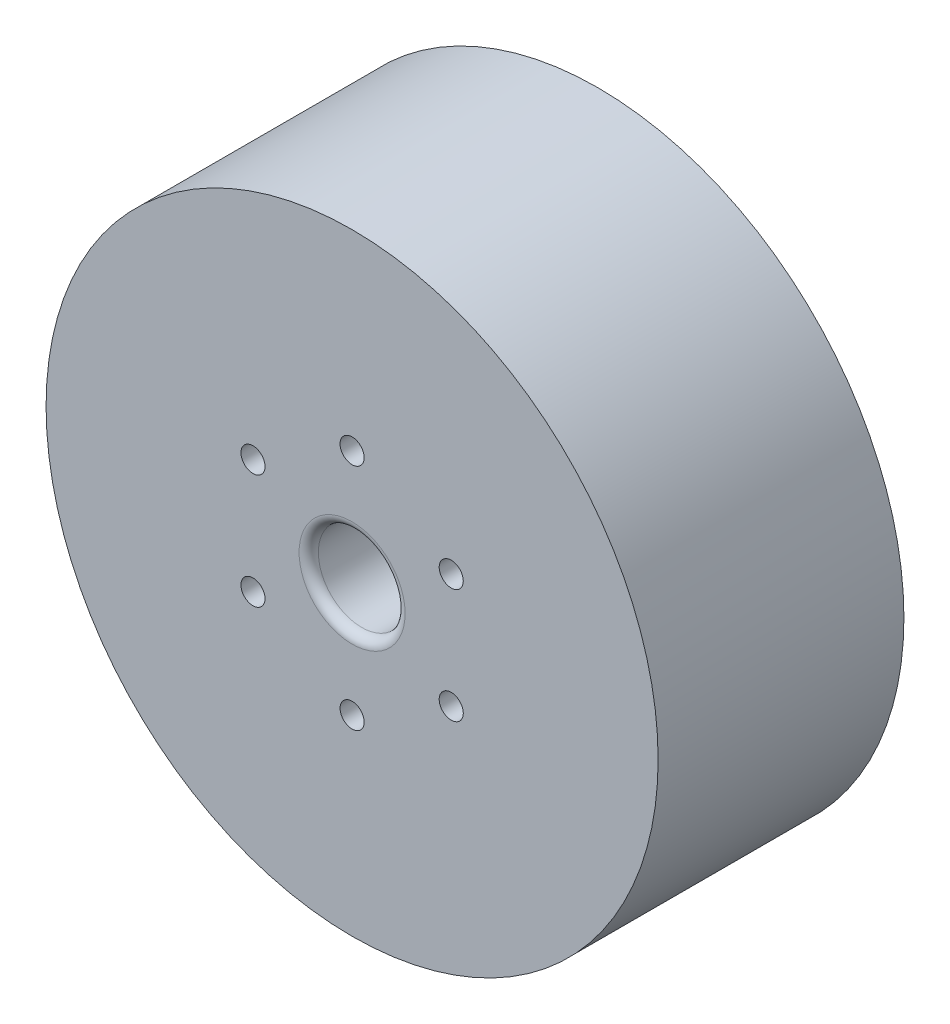
from build123d import *

# Parameters (mm, degrees)
SKETCH1_R           = 63.5
SKETCH1_R_2         = 9
SKETCH1_R_3         = 2.5
BOSS_EXTRUDE1_DEPTH = 25.5
FILLET1_R           = 2


with BuildPart() as part:
    # Sketch1 → Boss-Extrude1 (new, symmetric)
    with BuildSketch(Plane.XY):
        Circle(SKETCH1_R)
        Circle(SKETCH1_R_2, mode=Mode.SUBTRACT)
        with Locations((0, 23.75)):
            Circle(SKETCH1_R_3, mode=Mode.SUBTRACT)
        with Locations((20.56810334, 11.875)):
            Circle(SKETCH1_R_3, mode=Mode.SUBTRACT)
        with Locations((20.56810334, -11.875)):
            Circle(SKETCH1_R_3, mode=Mode.SUBTRACT)
        with Locations((0, -23.75)):
            Circle(SKETCH1_R_3, mode=Mode.SUBTRACT)
        with Locations((-20.56810334, -11.875)):
            Circle(SKETCH1_R_3, mode=Mode.SUBTRACT)
        with Locations((-20.56810334, 11.875)):
            Circle(SKETCH1_R_3, mode=Mode.SUBTRACT)
    extrude(amount=BOSS_EXTRUDE1_DEPTH, both=True)

    # Fillet1
    fillet1_edges = [part.edges().sort_by_distance(p)[0] for p in [
        (-9, 0, -25.5),
        (-9, 0, 25.5),
    ]]
    fillet(fillet1_edges, radius=FILLET1_R)


solid = part.part
